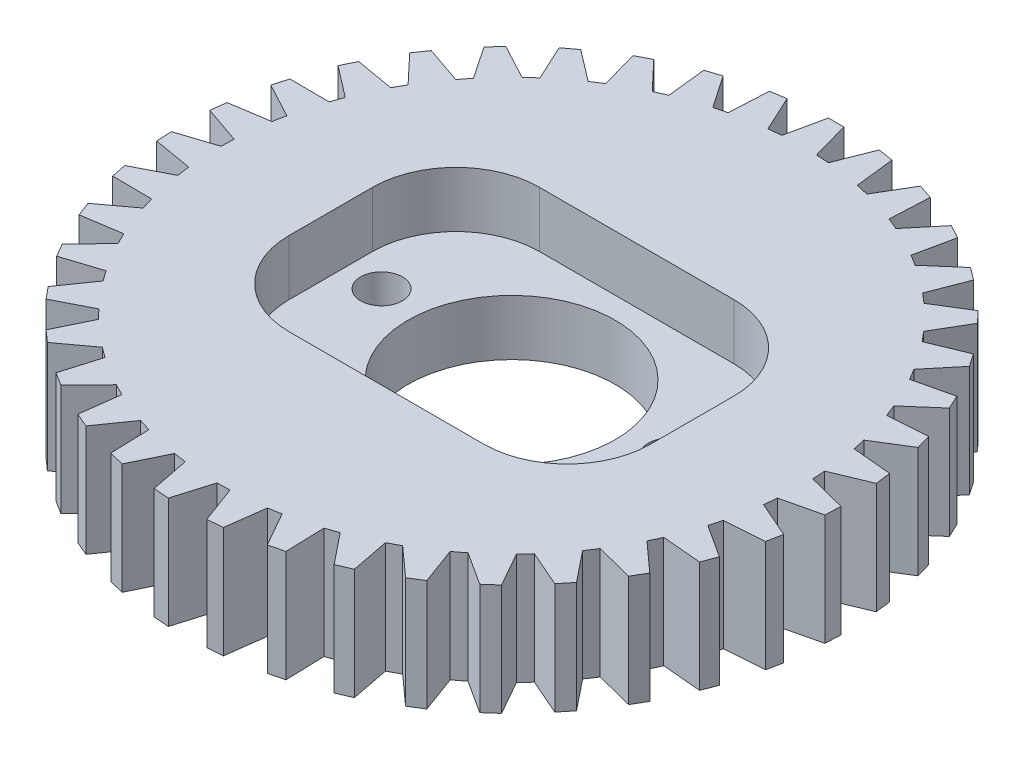
from build123d import *

# Parameters (mm, degrees)
SKETCH2_R           = 10.5
BOSS_EXTRUDE1_DEPTH = 4
SKETCH3_W           = 13
SKETCH3_H           = 9
CUT_EXTRUDE1_DEPTH  = 2
FILLET1_R           = 3
SKETCH4_R           = 3.725
SKETCH4_R_2         = 0.75
CUT_EXTRUDE2_DEPTH  = 15.983324064
BOSS_EXTRUDE2_START = -4
BOSS_EXTRUDE2_DEPTH = 4


with BuildPart() as part:
    # Sketch2 → Boss-Extrude1 (new body)
    with BuildSketch(Plane(origin=(0, 0, 0), x_dir=(1, 0, 0), z_dir=(0, 1, 0))):
        with Locations(Location((0, 0, 0), (0, 0, 270))):
            Circle(SKETCH2_R)
    extrude(amount=BOSS_EXTRUDE1_DEPTH)

    # Sketch3 → Cut-Extrude1 (cut)
    with BuildSketch(Plane(origin=(0, 4, 0), x_dir=(1, 0, 0), z_dir=(0, 1, 0))):
        Rectangle(SKETCH3_W, SKETCH3_H)
    extrude(amount=-CUT_EXTRUDE1_DEPTH, mode=Mode.SUBTRACT)

    # Fillet1
    fillet1_edges = [part.edges().sort_by_distance(p)[0] for p in [
        (6.5, 3, -4.5),
        (6.5, 3, 4.5),
        (-6.5, 3, 4.5),
        (-6.5, 3, -4.5),
    ]]
    fillet(fillet1_edges, radius=FILLET1_R)

    # Sketch4 → Cut-Extrude2 (cut, through all)
    with BuildSketch(Plane(origin=(0, 2, 0), x_dir=(1, 0, 0), z_dir=(0, 1, 0))):
        with Locations(Location((0, 0, 0), (0, 0, 270))):
            Circle(SKETCH4_R)
        with Locations(Location((-5.176126951, 0.497704515, 0), (0, 0, 270))):
            Circle(SKETCH4_R_2)
        with Locations(Location((5.176126951, 0.497704515, 0), (0, 0, 90))):
            Circle(SKETCH4_R_2)
    extrude(amount=-CUT_EXTRUDE2_DEPTH, mode=Mode.SUBTRACT)

    # Sketch5 → Boss-Extrude2 (add)
    with BuildSketch(Plane(origin=(0, 4, 0), x_dir=(1, 0, 0), z_dir=(0, 1, 0)).offset(BOSS_EXTRUDE2_START)):
        with BuildLine():
            Line((-0.757628273, 10.472630968), (-0.46141818, 11.853816835))
            Line((-0.46141818, 11.853816835), (0.093861365, 11.853816835))
            Line((0.093861365, 11.853816835), (0.477738985, 10.489126058))
            ThreePointArc((0.477738985, 10.489126058), (-0.140187465, 10.499064124), (-0.757628273, 10.472630968))
        make_face()
        with BuildLine():
            Line((1.994131826, 11.685256599), (2.154126537, 10.276659908))
            ThreePointArc((2.154126537, 10.276659908), (1.54579625, 10.385591652), (0.932110962, 10.45854527))
            Line((0.932110962, 10.45854527), (1.446043006, 11.774329702))
            Line((1.446043006, 11.774329702), (1.994131826, 11.685256599))
        make_face()
        with BuildLine():
            Line((3.842755321, 11.214054354), (3.774723342, 9.798033664))
            ThreePointArc((3.774723342, 9.798033664), (3.191744654, 10.003137811), (2.597709012, 10.173588742))
            Line((2.597709012, 10.173588742), (3.316052437, 11.389893614))
            Line((3.316052437, 11.389893614), (3.842755321, 11.214054354))
        make_face()
        with BuildLine():
            Line((5.591853472, 10.452413992), (5.297556797, 9.065643495))
            ThreePointArc((5.297556797, 9.065643495), (4.755028547, 9.361607956), (4.196027764, 9.62514161))
            Line((4.196027764, 9.62514161), (5.100177852, 10.710465264))
            Line((5.100177852, 10.710465264), (5.591853472, 10.452413992))
        make_face()
        with BuildLine():
            Line((7.196125554, 9.420061599), (6.683186312, 8.098457922))
            ThreePointArc((6.683186312, 8.098457922), (6.1951597, 8.477617371), (5.6856716, 8.827408366))
            Line((5.6856716, 8.827408366), (6.75221134, 9.75364149))
            Line((6.75221134, 9.75364149), (7.196125554, 9.420061599))
        make_face()
        with BuildLine():
            Line((8.614021765, 8.143734558), (7.895724813, 6.921526542))
            ThreePointArc((7.895724813, 6.921526542), (7.47483947, 7.37406095), (7.028059529, 7.801049882))
            Line((7.028059529, 7.801049882), (8.229366101, 8.544203525))
            Line((8.229366101, 8.544203525), (8.614021765, 8.143734558))
        make_face()
        with BuildLine():
            Line((9.808819337, 6.656489069), (8.903768189, 5.565331261))
            ThreePointArc((8.903768189, 5.565331261), (8.560924824, 6.079520224), (8.188424408, 6.572648304))
            Line((8.188424408, 6.572648304), (9.493384603, 7.113475176))
            Line((9.493384603, 7.113475176), (9.808819337, 6.656489069))
        make_face()
        with BuildLine():
            Line((10.74957364, 4.996844011), (9.681208645, 4.064996823))
            ThreePointArc((9.681208645, 4.064996823), (9.425286722, 4.627523118), (9.136713395, 5.174018587))
            Line((9.136713395, 5.174018587), (10.51152943, 5.498511557))
            Line((10.51152943, 5.498511557), (10.74957364, 4.996844011))
        make_face()
        with BuildLine():
            Line((11.411919633, 3.207783317), (10.207910883, 2.459381103))
            ThreePointArc((10.207910883, 2.459381103), (10.045538645, 3.055675593), (9.848366305, 3.641384506))
            Line((9.848366305, 3.641384506), (11.257431166, 3.741139377))
            Line((11.257431166, 3.741139377), (11.411919633, 3.207783317))
        make_face()
        with BuildLine():
            Line((11.778702901, 1.33564272), (10.470233591, 0.790068704))
            ThreePointArc((10.470233591, 0.790068704), (10.405616394, 1.404687676), (10.304951701, 2.01444048))
            Line((10.304951701, 2.01444048), (11.711771349, 1.886873652))
            Line((11.711771349, 1.886873652), (11.778702901, 1.33564272))
        make_face()
        with BuildLine():
            Line((11.840423952, -0.571090322), (10.461382748, -0.899706059))
            ThreePointArc((10.461382748, -0.899706059), (10.496194144, -0.282680914), (10.49464426, 0.335323503))
            Line((10.49464426, 0.335323503), (11.862782805, -0.01626111))
            Line((11.862782805, -0.01626111), (11.840423952, -0.571090322))
        make_face()
        with BuildLine():
            Line((11.595484241, -2.463032424), (10.181587588, -2.566178908))
            ThreePointArc((10.181587588, -2.566178908), (10.314925979, -1.962728218), (10.412531046, -1.352478176))
            Line((10.412531046, -1.352478176), (11.706554418, -1.918974717))
            Line((11.706554418, -1.918974717), (11.595484241, -2.463032424))
        make_face()
        with BuildLine():
            Line((11.05022758, -4.291183281), (9.638094657, -4.166189072))
            ThreePointArc((9.638094657, -4.166189072), (9.866506649, -3.591941891), (10.060738747, -3.005251381))
            Line((10.060738747, -3.005251381), (11.24713242, -3.771987887))
            Line((11.24713242, -3.771987887), (11.05022758, -4.291183281))
        make_face()
        with BuildLine():
            Line((10.218775829, -6.008194744), (8.844980137, -5.658297126))
            ThreePointArc((8.844980137, -5.658297126), (9.16254998, -5.128126156), (9.448378599, -4.580190153))
            Line((9.448378599, -4.580190153), (10.496415601, -5.527308552))
            Line((10.496415601, -5.527308552), (10.218775829, -6.008194744))
        make_face()
        with BuildLine():
            Line((9.122663151, -7.569597119), (7.822785278, -7.003858258))
            ThreePointArc((7.822785278, -7.003858258), (8.221288079, -6.531494647), (8.591310409, -6.036504407))
            Line((8.591310409, -6.036504407), (9.473847131, -7.139474829))
            Line((9.473847131, -7.139474829), (9.122663151, -7.569597119))
        make_face()
        with BuildLine():
            Line((7.79027829, -8.934950906), (6.597984389, -8.168023139))
            ThreePointArc((6.597984389, -8.168023139), (7.067099135, -7.765700858), (7.511731792, -7.336476367))
            Line((7.511731792, -7.336476367), (8.205910997, -8.566732458))
            Line((8.205910997, -8.566732458), (7.79027829, -8.934950906))
        make_face()
        with BuildLine():
            Line((6.256129313, -10.068894157), (5.20229917, -9.120640512))
            ThreePointArc((5.20229917, -9.120640512), (5.729876036, -8.798779496), (6.237603267, -8.446437443))
            Line((6.237603267, -8.446437443), (6.725446079, -9.772116216))
            Line((6.725446079, -9.772116216), (6.256129313, -10.068894157))
        make_face()
        with BuildLine():
            Line((4.559949873, -10.942058338), (3.671877136, -9.837038086))
            ThreePointArc((3.671877136, -9.837038086), (4.244252157, -9.603974366), (4.801924094, -9.337640226))
            Line((4.801924094, -9.337640226), (5.07079564, -10.724407297))
            Line((5.07079564, -10.724407297), (4.559949873, -10.942058338))
        make_face()
        with BuildLine():
            Line((2.745670126, -11.531828956), (2.046355412, -10.298661541))
            ThreePointArc((2.046355412, -10.298661541), (2.648704377, -10.160431345), (3.241877609, -9.987003032))
            Line((3.241877609, -9.987003032), (3.284814257, -11.398941863))
            Line((3.284814257, -11.398941863), (2.745670126, -11.531828956))
        make_face()
        with BuildLine():
            Line((0.860278966, -11.822931262), (0.367834158, -10.493555071))
            ThreePointArc((0.367834158, -10.493555071), (0.984556545, -10.45373849), (1.597868197, -10.377707706))
            Line((1.597868197, -10.377707706), (1.41375791, -11.778249822))
            Line((1.41375791, -11.778249822), (0.860278966, -11.822931262))
        make_face()
        with BuildLine():
            Line((-1.047392968, -11.807825858), (-1.320213807, -10.416671037))
            ThreePointArc((-1.320213807, -10.416671037), (-0.705090784, -10.476299298), (-0.087525162, -10.499635201))
            Line((-0.087525162, -10.499635201), (-0.493914024, -11.852507297))
            Line((-0.493914024, -11.852507297), (-1.047392968, -11.807825858))
        make_face()
        with BuildLine():
            Line((-2.927937974, -11.486903966), (-2.974068929, -10.070000696))
            ThreePointArc((-2.974068929, -10.070000696), (-2.376476633, -10.227529458), (-1.770651665, -10.349627659))
            Line((-1.770651665, -10.349627659), (-2.388793844, -11.61979106))
            Line((-2.388793844, -11.61979106), (-2.927937974, -11.486903966))
        make_face()
        with BuildLine():
            Line((-4.732650925, -10.868477296), (-4.550897227, -9.462522625))
            ThreePointArc((-4.550897227, -9.462522625), (-3.986312985, -9.713871977), (-3.40791922, -9.931570198))
            Line((-3.40791922, -9.931570198), (-4.221805158, -11.086128337))
            Line((-4.221805158, -11.086128337), (-4.732650925, -10.868477296))
        make_face()
        with BuildLine():
            Line((-6.414790703, -9.968562773), (-6.009859678, -8.609970189))
            ThreePointArc((-6.009859678, -8.609970189), (-5.492905925, -8.948630314), (-4.956923458, -9.256290285))
            Line((-4.956923458, -9.256290285), (-5.945473936, -10.265340714))
            Line((-5.945473936, -10.265340714), (-6.414790703, -9.968562773))
        make_face()
        with BuildLine():
            Line((-7.93079077, -8.81046771), (-7.313169919, -7.534424048))
            ThreePointArc((-7.313169919, -7.534424048), (-6.857235486, -7.951623827), (-6.377545981, -8.341277316))
            Line((-6.377545981, -8.341277316), (-7.515158063, -9.178686158))
            Line((-7.515158063, -9.178686158), (-7.93079077, -8.81046771))
        make_face()
        with BuildLine():
            Line((-9.241387523, -7.424186162), (-8.427072902, -6.263740281))
            ThreePointArc((-8.427072902, -6.263740281), (-8.043966251, -6.748674459), (-7.632993414, -7.210229646))
            Line((-7.632993414, -7.210229646), (-8.890203543, -7.854308452))
            Line((-8.890203543, -7.854308452), (-9.241387523, -7.424186162))
        make_face()
        with BuildLine():
            Line((-10.312637193, -5.845622091), (-9.322719122, -4.830828932))
            ThreePointArc((-9.322719122, -4.830828932), (-9.022362515, -5.370937968), (-8.690750327, -5.892440815))
            Line((-8.690750327, -5.892440815), (-10.034997421, -6.326508283))
            Line((-10.034997421, -6.326508283), (-10.312637193, -5.845622091))
        make_face()
        with BuildLine():
            Line((-11.116794977, -4.115659479), (-9.976911815, -3.27280165))
            ThreePointArc((-9.976911815, -3.27280165), (-9.767084328, -3.854097005), (-9.523421371, -4.422040863))
            Line((-9.523421371, -4.422040863), (-10.919890137, -4.634854873))
            Line((-10.919890137, -4.634854873), (-11.116794977, -4.115659479))
        make_face()
        with BuildLine():
            Line((-11.633033611, -2.279103449), (-10.372707732, -1.630010525))
            ThreePointArc((-10.372707732, -1.630010525), (-10.258843789, -2.237436953), (-10.109440804, -2.837112374))
            Line((-10.109440804, -2.837112374), (-11.521963434, -2.823161156))
            Line((-11.521963434, -2.823161156), (-11.633033611, -2.279103449))
        make_face()
        with BuildLine():
            Line((-11.847982784, -0.383519836), (-10.499855967, 0.054997016))
            ThreePointArc((-10.499855967, 0.054997016), (-10.484904583, -0.56282846), (-10.433631031, -1.178704166))
            Line((-10.433631031, -1.178704166), (-11.825623931, -0.938349048))
            Line((-11.825623931, -0.938349048), (-11.847982784, -0.383519836))
        make_face()
        with BuildLine():
            Line((-11.756075427, 1.521996739), (-10.355063448, 1.738580164))
            ThreePointArc((-10.355063448, 1.738580164), (-10.439411857, 1.126356995), (-10.487595694, 0.510231861))
            Line((-10.487595694, 0.510231861), (-11.82300698, 0.970765807))
            Line((-11.82300698, 0.970765807), (-11.756075427, 1.521996739))
        make_face()
        with BuildLine():
            Line((-11.359691891, 3.388094398), (-9.942080225, 3.377134998))
            ThreePointArc((-9.942080225, 3.377134998), (-10.123543847, 2.786370395), (-10.269937138, 2.185953151))
            Line((-10.269937138, 2.185953151), (-11.514180358, 2.854738338))
            Line((-11.514180358, 2.854738338), (-11.359691891, 3.388094398))
        make_face()
        with BuildLine():
            Line((-10.669098303, 5.166442192), (-9.271602347, 4.92822381))
            ThreePointArc((-9.271602347, 4.92822381), (-9.545481369, 4.374218265), (-9.786292605, 3.805059402))
            Line((-9.786292605, 3.805059402), (-10.907142513, 4.664774646))
            Line((-10.907142513, 4.664774646), (-10.669098303, 5.166442192))
        make_face()
        with BuildLine():
            Line((-9.702180672, 6.810981847), (-8.360994838, 6.351674214))
            ThreePointArc((-8.360994838, 6.351674214), (-8.720195938, 5.84877618), (-9.049188233, 5.325616614))
            Line((-9.049188233, 5.325616614), (-10.017615406, 6.35399574))
            Line((-10.017615406, 6.35399574), (-9.702180672, 6.810981847))
        make_face()
        with BuildLine():
            Line((-8.483981659, 8.27912065), (-7.233841954, 7.610619593))
            ThreePointArc((-7.233841954, 7.610619593), (-7.669062012, 7.171853865), (-8.07771464, 6.708243153))
            Line((-8.07771464, 6.708243153), (-8.868637322, 7.878651683))
            Line((-8.868637322, 7.878651683), (-8.483981659, 8.27912065))
        make_face()
        with BuildLine():
            Line((-7.046051977, 9.532834576), (-5.919336364, 8.672453921))
            ThreePointArc((-5.919336364, 8.672453921), (-6.419303409, 8.309184301), (-6.89703248, 7.917129717))
            Line((-6.89703248, 7.917129717), (-7.48996619, 9.199254685))
            Line((-7.48996619, 9.199254685), (-7.046051977, 9.532834576))
        make_face()
        with BuildLine():
            Line((-5.425633249, 10.539653095), (-4.451523071, 9.509676248))
            ThreePointArc((-4.451523071, 9.509676248), (-5.003288219, 9.231311229), (-5.537720803, 8.920966781))
            Line((-5.537720803, 8.920966781), (-5.917308868, 10.281601823))
            Line((-5.917308868, 10.281601823), (-5.425633249, 10.539653095))
        make_face()
        with BuildLine():
            Line((-3.664693471, 11.273500134), (-2.868417669, 10.100602956))
            ThreePointArc((-2.868417669, 10.100602956), (-3.457690492, 9.914352044), (-4.034985065, 9.693755491))
            Line((-4.034985065, 9.693755491), (-4.191396355, 11.097660875))
            Line((-4.191396355, 11.097660875), (-3.664693471, 11.273500134))
        make_face()
        with BuildLine():
            Line((-1.808840057, 11.715369442), (-1.211021756, 10.429929353))
            ThreePointArc((-1.211021756, 10.429929353), (-1.822540398, 10.34061635), (-2.427745333, 10.215481026))
            Line((-2.427745333, 10.215481026), (-2.356928878, 11.626296339))
            Line((-2.356928878, 11.626296339), (-1.808840057, 11.715369442))
        make_face()
    extrude(amount=BOSS_EXTRUDE2_DEPTH)


solid = part.part
